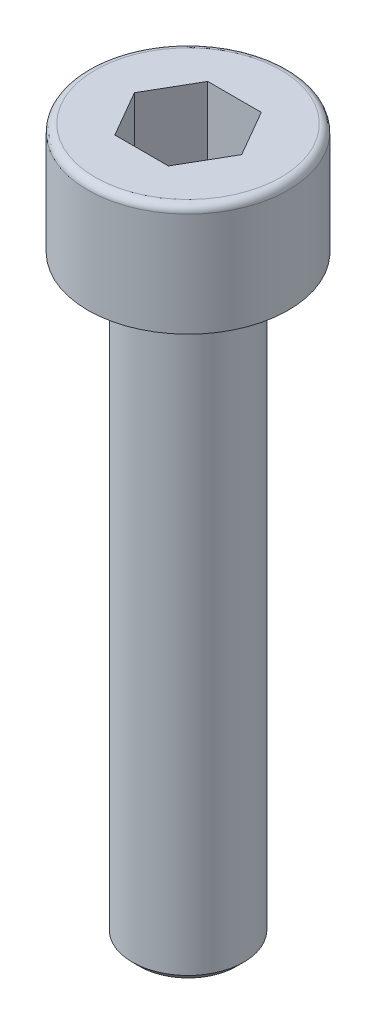
from build123d import *

# Parameters (mm, degrees)
CUT_EXTRUDE1_DEPTH = 2


with BuildPart() as part:
    # Sketch1 → Revolve1 (revolve)
    with BuildSketch(Plane(origin=(0, 0, 0), x_dir=(0, 0, -1), z_dir=(1, 0, 0)), mode=Mode.PRIVATE) as revolve1_sk:
        with BuildLine():
            Line((0, 3), (0, -16))
            Line((0, -16), (1.3, -16))
            Line((1.3, -16), (1.5, -15.8))
            Line((1.5, -15.8), (1.5, -0.2))
            ThreePointArc((1.5, -0.2), (1.558578644, -0.058578644), (1.7, 0))
            Line((1.7, 0), (2.7, 0))
            Line((2.7, 0), (2.7, 2.8))
            ThreePointArc((2.7, 2.8), (2.641421356, 2.941421356), (2.5, 3))
            Line((2.5, 3), (0, 3))
        make_face()
    revolve(revolve1_sk.sketch.rotate(Axis((0, 11.82745098, 0), (0, -1, 0)), 180), axis=Axis((0, 11.82745098, 0), (0, -1, 0)))

    # Sketch2 → Cut-Extrude1 (cut)
    with BuildSketch(Plane(origin=(0, 3, 0), x_dir=(1, 0, 0), z_dir=(0, 1, 0))):
        Polygon((0.721687836, 1.25), (-0.721687836, 1.25), (-1.443375673, 0), (-0.721687836, -1.25), (0.721687836, -1.25), (1.443375673, 0), align=None)
    extrude(amount=-CUT_EXTRUDE1_DEPTH, mode=Mode.SUBTRACT)


solid = part.part
